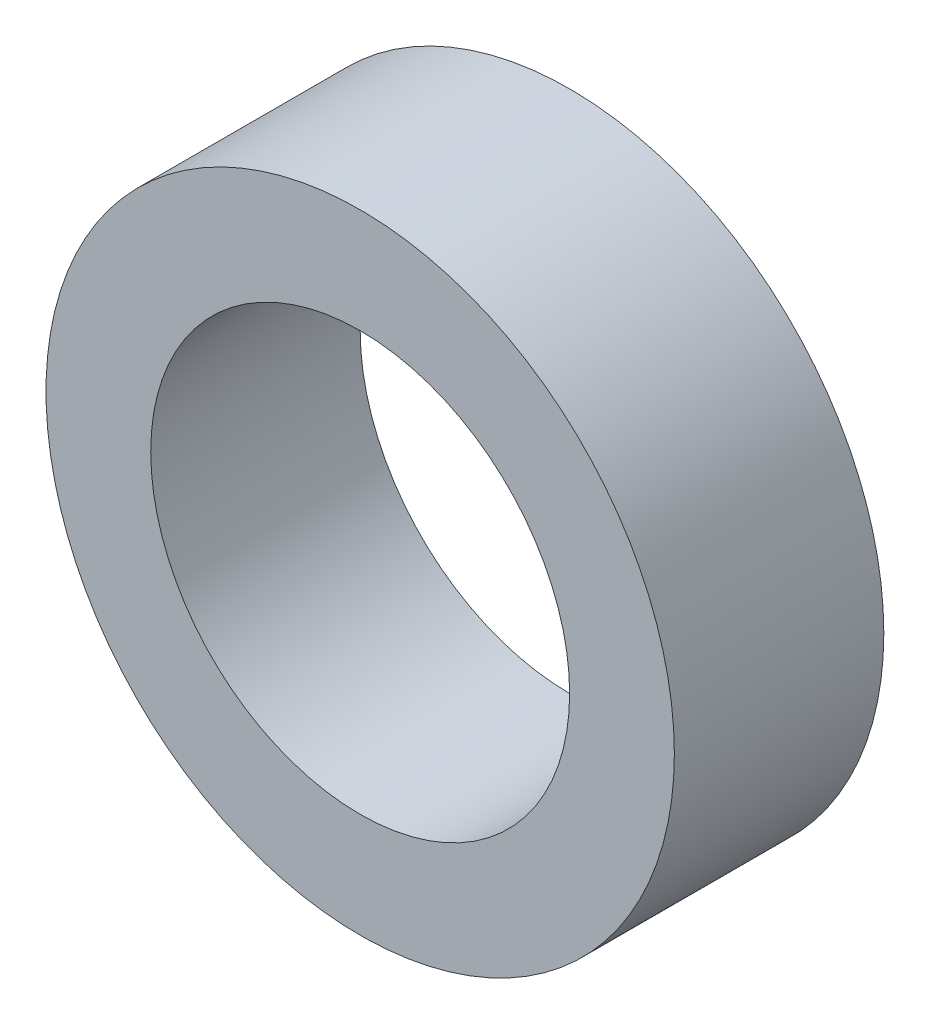
from build123d import *

# Parameters (mm, degrees)
SKETCH1_R           = 1.905
SKETCH1_R_2         = 1.27
BOSS_EXTRUDE1_DEPTH = 0.635
SCALE1_SCALE        = 1.5


with BuildPart() as part:
    # Sketch1 → Boss-Extrude1 (new, symmetric)
    with BuildSketch(Plane.XY):
        Circle(SKETCH1_R)
        Circle(SKETCH1_R_2, mode=Mode.SUBTRACT)
    extrude(amount=BOSS_EXTRUDE1_DEPTH, both=True)


with BuildPart() as part_1:
    # Scale1: scaled about (0, 0, 0)
    add(part.part.scale(SCALE1_SCALE))


solid = part_1.part
